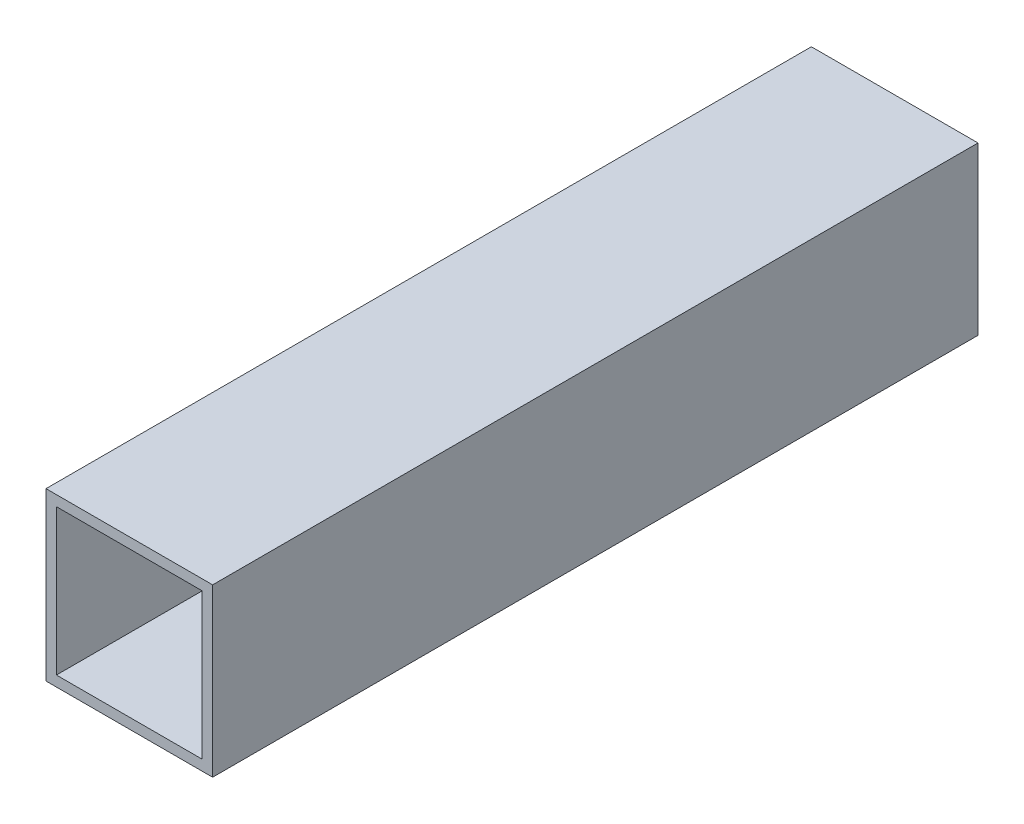
from build123d import *

# Parameters (mm, degrees)
CROQUIS2_W              = 76.2
CROQUIS2_H              = 76.2
CROQUIS2_W_2            = 66.675
CROQUIS2_H_2            = 66.675
SALIENTE_EXTRUIR1_DEPTH = 350


with BuildPart() as part:
    # Croquis2 → Saliente-Extruir1 (new body)
    with BuildSketch(Plane.XY):
        with Locations((38.1, -38.1)):
            Rectangle(CROQUIS2_W, CROQUIS2_H)
        with Locations((38.1, -38.1)):
            Rectangle(CROQUIS2_W_2, CROQUIS2_H_2, mode=Mode.SUBTRACT)
    extrude(amount=-SALIENTE_EXTRUIR1_DEPTH)


solid = part.part
